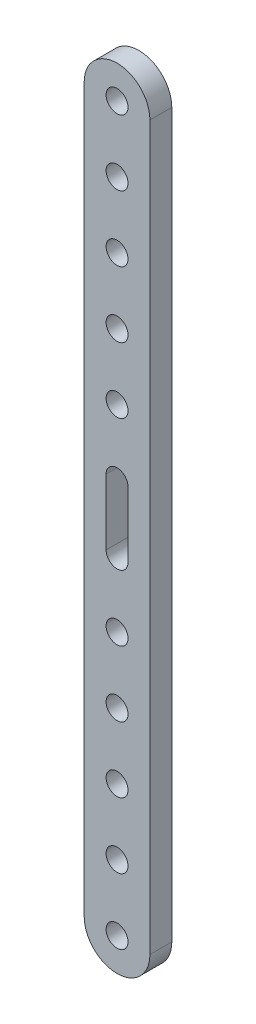
from build123d import *

# Parameters (mm, degrees)
MODEL_R                 = 1.5
SALIENTE_EXTRUIR1_DEPTH = 3


with BuildPart() as part:
    # Model → Saliente-Extruir1 (new body)
    with BuildSketch(Plane.XY):
        with BuildLine():
            Line((213.25077615, 89.428489513), (213.25077615, 188.428489513))
            ThreePointArc((213.25077615, 188.428489513), (208.75077615, 192.928489513), (204.25077615, 188.428489513))
            Line((204.25077615, 188.428489513), (204.25077615, 89.428489513))
            ThreePointArc((204.25077615, 89.428489513), (208.75077615, 84.928489513), (213.25077615, 89.428489513))
        make_face()
        with Locations((208.75077615, 179.428489513)):
            Circle(MODEL_R, mode=Mode.SUBTRACT)
        with Locations((208.75077615, 188.428489513)):
            Circle(MODEL_R, mode=Mode.SUBTRACT)
        with Locations((208.75077615, 152.428489513)):
            Circle(MODEL_R, mode=Mode.SUBTRACT)
        with Locations((208.75077615, 161.428489513)):
            Circle(MODEL_R, mode=Mode.SUBTRACT)
        with Locations((208.75077615, 170.428489513)):
            Circle(MODEL_R, mode=Mode.SUBTRACT)
        with Locations((208.75077615, 116.428489513)):
            Circle(MODEL_R, mode=Mode.SUBTRACT)
        with Locations((208.75077615, 125.428489513)):
            Circle(MODEL_R, mode=Mode.SUBTRACT)
        with Locations((208.75077615, 89.428489513)):
            Circle(MODEL_R, mode=Mode.SUBTRACT)
        with Locations((208.75077615, 98.428489513)):
            Circle(MODEL_R, mode=Mode.SUBTRACT)
        with Locations((208.75077615, 107.428489513)):
            Circle(MODEL_R, mode=Mode.SUBTRACT)
        with BuildLine():
            Line((207.25077615, 134.428489513), (207.25077615, 143.428489513))
            ThreePointArc((207.25077615, 143.428489513), (208.75077615, 144.928489513), (210.25077615, 143.428489513))
            Line((210.25077615, 143.428489513), (210.25077615, 134.428489513))
            ThreePointArc((210.25077615, 134.428489513), (208.75077615, 132.928489513), (207.25077615, 134.428489513))
        make_face(mode=Mode.SUBTRACT)
    extrude(amount=SALIENTE_EXTRUIR1_DEPTH)


solid = part.part
